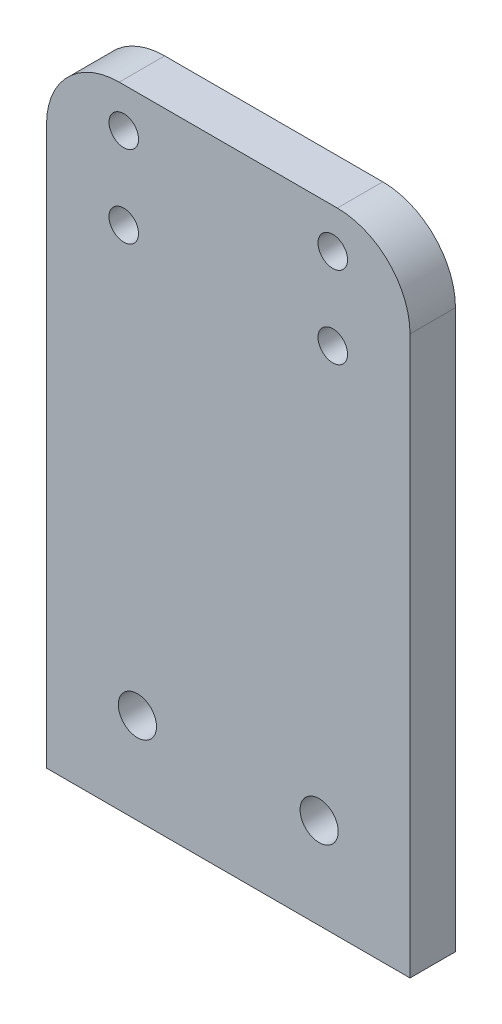
from build123d import *

# Parameters (mm, degrees)
SKETCH1_W                = 80
SKETCH1_H                = 138.754765379
BOSS_EXTRUDE1_DEPTH      = 10
FORO_PER_VITE_M8_1_D     = 8.4
SCHIZZO1_R               = 3.25
TAGLIO_ESTRUSIONE1_DEPTH = 2604.992537461
RACCORDO1_R              = 16


with BuildPart() as part:
    # Sketch1 → Boss-Extrude1 (new body)
    with BuildSketch(Plane.XY):
        with Locations((-1780.42117355, -1792.542026427)):
            Rectangle(SKETCH1_W, SKETCH1_H)
    extrude(amount=BOSS_EXTRUDE1_DEPTH)

    # Foro per Vite M8-1 (through all)
    with Locations(Plane.XY.offset(10)):
        with Locations((-1760.42117355, -1841.919409116), (-1800.42117355, -1841.919409116)):
            Hole(FORO_PER_VITE_M8_1_D / 2)

    # Schizzo1 → Taglio-Estrusione1 (cut, through all)
    with BuildSketch(Plane.XY.offset(10)):
        with Locations((-1803.421173548, -1731.919409116)):
            Circle(SCHIZZO1_R)
        with Locations((-1803.421173548, -1749.919409116)):
            Circle(SCHIZZO1_R)
        with Locations((-1757.421173548, -1731.919409116)):
            Circle(SCHIZZO1_R)
        with Locations((-1757.421173548, -1749.919409116)):
            Circle(SCHIZZO1_R)
    extrude(amount=-TAGLIO_ESTRUSIONE1_DEPTH, mode=Mode.SUBTRACT)

    # Raccordo1
    raccordo1_edges = [part.edges().sort_by_distance(p)[0] for p in [
        (-1820.42117355, -1723.164643737, 5),
        (-1740.42117355, -1723.164643737, 5),
    ]]
    fillet(raccordo1_edges, radius=RACCORDO1_R)


solid = part.part
